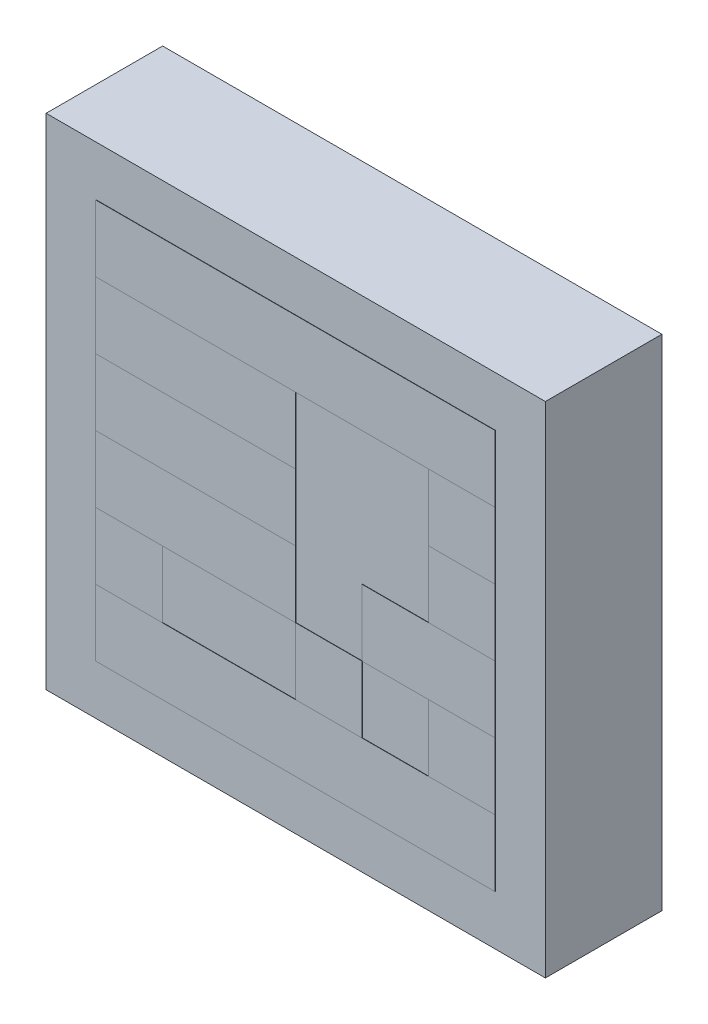
from build123d import *

# Parameters (mm, degrees)
SKETCH_1_W                     = 60
SKETCH_1_H                     = 60
COPLANAR_SUPPORT60X60X14_DEPTH = 14
SKETCH_2_W                     = 48
SKETCH_2_H                     = 8
ID2_ROW0_DEPTH                 = 0.04
SKETCH_3_W                     = 24
SKETCH_3_H                     = 8
ID2_ROW1_DEPTH                 = 0.04
SKETCH_3_W_2                   = 8
ID2_ROW1_2_DEPTH               = 0.04
SKETCH_4_W                     = 24
SKETCH_4_H                     = 8
ID2_ROW2_DEPTH                 = 0.04
SKETCH_4_W_2                   = 8
ID2_ROW2_2_DEPTH               = 0.04
SKETCH_5_W                     = 24
SKETCH_5_H                     = 8
ID2_ROW3_DEPTH                 = 0.04
SKETCH_5_W_2                   = 16
ID2_ROW3_2_DEPTH               = 0.04
SKETCH_6_W                     = 8
SKETCH_6_H                     = 8
ID2_ROW4_DEPTH                 = 0.04
ID2_ROW4_2_DEPTH               = 0.04
ID2_ROW4_3_DEPTH               = 0.04
SKETCH_7_W                     = 48
SKETCH_7_H                     = 8
ID2_ROW5_DEPTH                 = 0.04


with BuildPart() as part:
    # 草图1 → Coplanar_support60x60x14 (new body)
    with BuildSketch(Plane.XY):
        Rectangle(SKETCH_1_W, SKETCH_1_H)
    extrude(amount=-COPLANAR_SUPPORT60X60X14_DEPTH)


with BuildPart() as body_2:
    # 草图2 → ID2_row0 (new body)
    with BuildSketch(Plane.XY):
        with Locations((0, 20)):
            Rectangle(SKETCH_2_W, SKETCH_2_H)
    extrude(amount=ID2_ROW0_DEPTH)


with BuildPart() as body_3:
    # 草图3 → ID2_row1 (new body)
    with BuildSketch(Plane.XY):
        with Locations((-12, 12)):
            Rectangle(SKETCH_3_W, SKETCH_3_H)
    extrude(amount=ID2_ROW1_DEPTH)


with BuildPart() as body_4:
    # 草图3 → ID2_row1 2 (new body)
    with BuildSketch(Plane.XY):
        with Locations((20, 12)):
            Rectangle(SKETCH_3_W_2, SKETCH_3_H)
    extrude(amount=ID2_ROW1_2_DEPTH)


with BuildPart() as body_5:
    # 草图4 → ID2_row2 (new body)
    with BuildSketch(Plane.XY):
        with Locations((-12, 4)):
            Rectangle(SKETCH_4_W, SKETCH_4_H)
    extrude(amount=ID2_ROW2_DEPTH)


with BuildPart() as body_6:
    # 草图4 → ID2_row2 2 (new body)
    with BuildSketch(Plane.XY):
        with Locations((20, 4)):
            Rectangle(SKETCH_4_W_2, SKETCH_4_H)
    extrude(amount=ID2_ROW2_2_DEPTH)


with BuildPart() as body_7:
    # 草图5 → ID2_row3 (new body)
    with BuildSketch(Plane.XY):
        with Locations((-12, -4)):
            Rectangle(SKETCH_5_W, SKETCH_5_H)
    extrude(amount=ID2_ROW3_DEPTH)


with BuildPart() as body_8:
    # 草图5 → ID2_row3 2 (new body)
    with BuildSketch(Plane.XY):
        with Locations((16, -4)):
            Rectangle(SKETCH_5_W_2, SKETCH_5_H)
    extrude(amount=ID2_ROW3_2_DEPTH)


with BuildPart() as body_9:
    # 草图6 → ID2_row4 (new body)
    with BuildSketch(Plane.XY):
        with Locations((-20, -12)):
            Rectangle(SKETCH_6_W, SKETCH_6_H)
    extrude(amount=ID2_ROW4_DEPTH)


with BuildPart() as body_10:
    # 草图6 → ID2_row4 2 (new body)
    with BuildSketch(Plane.XY):
        with Locations((4, -12)):
            Rectangle(SKETCH_6_W, SKETCH_6_H)
    extrude(amount=ID2_ROW4_2_DEPTH)


with BuildPart() as body_11:
    # 草图6 → ID2_row4 3 (new body)
    with BuildSketch(Plane.XY):
        with Locations((20, -12)):
            Rectangle(SKETCH_6_W, SKETCH_6_H)
    extrude(amount=ID2_ROW4_3_DEPTH)


with BuildPart() as body_12:
    # 草图7 → ID2_row5 (new body)
    with BuildSketch(Plane.XY):
        with Locations((0, -20)):
            Rectangle(SKETCH_7_W, SKETCH_7_H)
    extrude(amount=ID2_ROW5_DEPTH)


solid = Compound([part.part, body_2.part, body_3.part, body_4.part, body_5.part, body_6.part, body_7.part, body_8.part, body_9.part, body_10.part, body_11.part, body_12.part])
